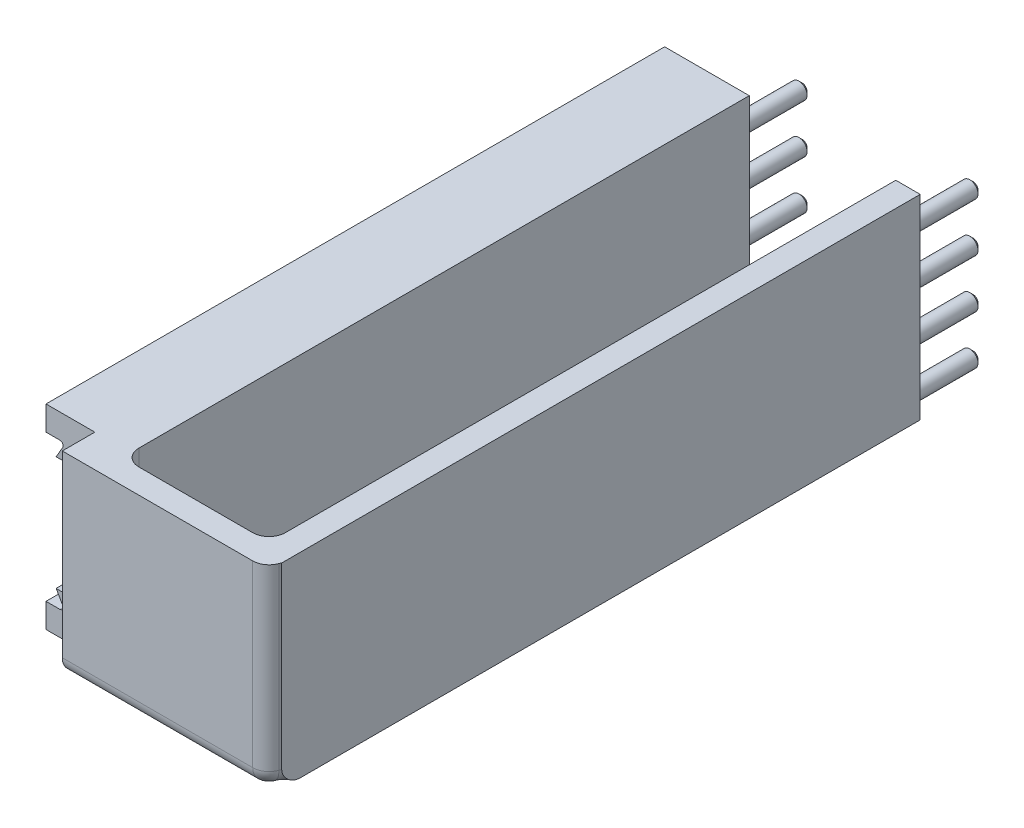
from build123d import *

# Parameters (mm, degrees)
SURFACE_EXTRUDE1_1_DEPTH = 120
THICKEN1_T2              = 15
SKETCH5_W                = 90
SKETCH5_H                = 120
CUT_EXTRUDE1_DEPTH       = 120
SKETCH4_W                = 120
SKETCH4_H                = 400
THICKEN2_T1              = 12
FILLET1_R                = 10
FILLET2_R                = 10
SKETCH6_R                = 5
BOSS_EXTRUDE1_DEPTH      = 40
CHAMFER1_SIZE            = 2
CHAMFER2_SIZE            = 2
SKETCH7_W                = 390
SKETCH7_H                = 120
BOSS_EXTRUDE2_DEPTH      = 40
CUT_EXTRUDE2_DEPTH       = 422
FILLET3_R                = 5
SKETCH9_W                = 3
SKETCH9_H                = 120
CUT_EXTRUDE3_DEPTH       = 440
FILLET4_R                = 2
FILLET5_R                = 2
FILLET6_R                = 2
SKETCH12_W               = 37
SKETCH12_H               = 120
CUT_EXTRUDE5_DEPTH       = 413
SKETCH13_W               = 30
SKETCH13_H               = 120
CUT_EXTRUDE6_DEPTH       = 20
SKETCH14_W               = 10
SKETCH14_H               = 120
BOSS_EXTRUDE3_DEPTH      = 7
FILLET7_R                = 10


with BuildPart() as body_1:
    # Surface-Extrude1: a surface, the sketch's curves swept straight by 120 mm
    with BuildLine(Plane(origin=(0, 0, 0), x_dir=(1, 0, 0), z_dir=(0, 1, 0)), mode=Mode.PRIVATE) as surface_extrude1_1_path:
        Line((60, -200), (-60, -200))
        Line((-60, -200), (-60, 200))
        Line((-60, 200), (60, 200))
        Line((60, 200), (60, -200))
    surface_extrude1_1 = Shell.extrude(surface_extrude1_1_path.wire(), (0 * SURFACE_EXTRUDE1_1_DEPTH, 1 * SURFACE_EXTRUDE1_1_DEPTH, 0 * SURFACE_EXTRUDE1_1_DEPTH))
    add(Solid.thicken(surface_extrude1_1, -THICKEN1_T2))

    # Sketch5 → Cut-Extrude1 (cut)
    with BuildSketch(Plane.XY.offset(-185)):
        with Locations((0, 60)):
            Rectangle(SKETCH5_W, SKETCH5_H)
    extrude(amount=-CUT_EXTRUDE1_DEPTH, mode=Mode.SUBTRACT)

    # Sketch4 → Surface-Plane1: a flat surface bounded by the sketch
    with BuildSketch(Plane(origin=(0, 0, 0), x_dir=(1, 0, 0), z_dir=(0, 1, 0)), mode=Mode.PRIVATE) as surface_plane1_2_region:
        Rectangle(SKETCH4_W, SKETCH4_H)
    surface_plane1_2 = surface_plane1_2_region.sketch.faces()[0]
    add(Solid.thicken(surface_plane1_2, THICKEN2_T1))

    # Fillet1
    fillet1_edges = [body_1.edges().sort_by_distance(p)[0] for p in [
        (45, 66, 185),
        (45, 12, -7.5),
        (-45, 66, 185),
        (0, 12, 185),
        (-45, 12, -7.5),
    ]]
    fillet(fillet1_edges, radius=FILLET1_R)

    # Fillet2
    fillet2_edges = [body_1.edges().sort_by_distance(p)[0] for p in [
        (60, 60, 200),
    ]]
    fillet(fillet2_edges, radius=FILLET2_R)

    # Sketch6 → Boss-Extrude1 (add)
    with BuildSketch(Plane(origin=(0, 0, -200), x_dir=(-1, 0, 0), z_dir=(0, 0, -1))):
        with Locations((-52.5, 100)):
            Circle(SKETCH6_R)
        with Locations((52.5, 100)):
            Circle(SKETCH6_R)
        with Locations((-52.5, 70)):
            Circle(SKETCH6_R)
        with Locations((-52.5, 40)):
            Circle(SKETCH6_R)
        with Locations((-52.5, 10)):
            Circle(SKETCH6_R)
        with Locations((52.5, 70)):
            Circle(SKETCH6_R)
        with Locations((52.5, 40)):
            Circle(SKETCH6_R)
        with Locations((52.5, 10)):
            Circle(SKETCH6_R)
    extrude(amount=BOSS_EXTRUDE1_DEPTH)

    # Chamfer1
    chamfer1_edges = [body_1.edges().sort_by_distance(p)[0] for p in [
        (57.5, 100, -240),
        (57.5, 70, -240),
        (57.5, 40, -240),
        (57.5, 10, -240),
    ]]
    chamfer(chamfer1_edges, length=CHAMFER1_SIZE)

    # Chamfer2
    chamfer2_edges = [body_1.edges().sort_by_distance(p)[0] for p in [
        (-47.5, 100, -240),
        (-47.5, 70, -240),
        (-47.5, 40, -240),
        (-47.5, 10, -240),
    ]]
    chamfer(chamfer2_edges, length=CHAMFER2_SIZE)

    # Sketch7 → Boss-Extrude2 (add)
    with BuildSketch(Plane(origin=(60, 0, 0), x_dir=(0, 0, -1), z_dir=(1, 0, 0))):
        with Locations((5, 60)):
            Rectangle(SKETCH7_W, SKETCH7_H)
    boss_extrude2 = extrude(amount=BOSS_EXTRUDE2_DEPTH)

    # Sketch8 → Cut-Extrude2 (cut)
    with BuildSketch(Plane(origin=(0, 0, -200), x_dir=(-1, 0, 0), z_dir=(0, 0, -1))):
        Polygon((-100, 105), (-100, 15), (-85, 15), (-90.773502692, 25), (-69.226497308, 25), (-75, 15), (-67, 15), (-67, 105), (-75, 105), (-69.226497308, 95), (-90.773502692, 95), (-85, 105), align=None)
    cut_extrude2 = extrude(amount=-CUT_EXTRUDE2_DEPTH, mode=Mode.SUBTRACT)

    # Fillet3
    fillet3_edges = [body_1.edges().sort_by_distance(p)[0] for p in [
        (60, 60, 190),
    ]]
    fillet(fillet3_edges, radius=FILLET3_R)

    # Sketch9 → Cut-Extrude3 (cut)
    with BuildSketch(Plane(origin=(0, 0, -200), x_dir=(-1, 0, 0), z_dir=(0, 0, -1))):
        with Locations((-98.5, 60)):
            Rectangle(SKETCH9_W, SKETCH9_H)
    cut_extrude3 = extrude(amount=-CUT_EXTRUDE3_DEPTH, mode=Mode.SUBTRACT)

    # Fillet4
    fillet4_edges = [body_1.edges().sort_by_distance(p)[0] for p in [
        (85, 105, -5),
        (75, 105, -5),
        (75, 15, -5),
        (85, 15, -5),
    ]]
    fillet(fillet4_edges, radius=FILLET4_R)

    # Fillet5
    fillet5_edges = [body_1.edges().sort_by_distance(p)[0] for p in [
        (69.226497308, 25, -5),
        (69.226497308, 95, -5),
    ]]
    fillet(fillet5_edges, radius=FILLET5_R)

    # Mirror1: Boss-Extrude2 across plane
    add(boss_extrude2.mirror(Plane(origin=(0, 0, 0), x_dir=(0, 0, 1), z_dir=(1, 0, 0))))

    # Mirror2: Cut-Extrude2 across plane
    add(cut_extrude2.mirror(Plane(origin=(0, 0, 0), x_dir=(0, 0, 1), z_dir=(1, 0, 0))), mode=Mode.SUBTRACT)

    # Fillet6
    fillet6_edges = [body_1.edges().sort_by_distance(p)[0] for p in [
        (-69.226497308, 25, -5),
        (-75, 15, -5),
        (-75, 105, -5),
        (-69.226497308, 95, -5),
        (-85, 105, -5),
        (-85, 15, -5),
    ]]
    fillet(fillet6_edges, radius=FILLET6_R)

    # Sketch12 → Cut-Extrude5 (cut)
    with BuildSketch(Plane(origin=(0, 0, -200), x_dir=(-1, 0, 0), z_dir=(0, 0, -1))):
        with Locations((-78.5, 60)):
            Rectangle(SKETCH12_W, SKETCH12_H)
    extrude(amount=-CUT_EXTRUDE5_DEPTH, mode=Mode.SUBTRACT)

    # Mirror3: Cut-Extrude3 across plane
    add(cut_extrude3.mirror(Plane(origin=(0, 0, 0), x_dir=(0, 0, 1), z_dir=(1, 0, 0))), mode=Mode.SUBTRACT)

    # Sketch13 → Cut-Extrude6 (cut)
    with BuildSketch(Plane.XY.offset(180)):
        with Locations((-82, 60)):
            Rectangle(SKETCH13_W, SKETCH13_H)
    extrude(amount=CUT_EXTRUDE6_DEPTH, mode=Mode.SUBTRACT)

    # Sketch14 → Boss-Extrude3 (add)
    with BuildSketch(Plane.ZY.offset(60)):
        with Locations((195, 60)):
            Rectangle(SKETCH14_W, SKETCH14_H)
    extrude(amount=BOSS_EXTRUDE3_DEPTH)

    # Fillet7
    fillet7_edges = [body_1.edges().sort_by_distance(p)[0] for p in [
        (-8.5, 0, 200),
        (55.773502692, 0, 198.164965809),
        (59.677903287, 0, 192.748194137),
    ]]
    fillet(fillet7_edges, radius=FILLET7_R)


solid = body_1.part
